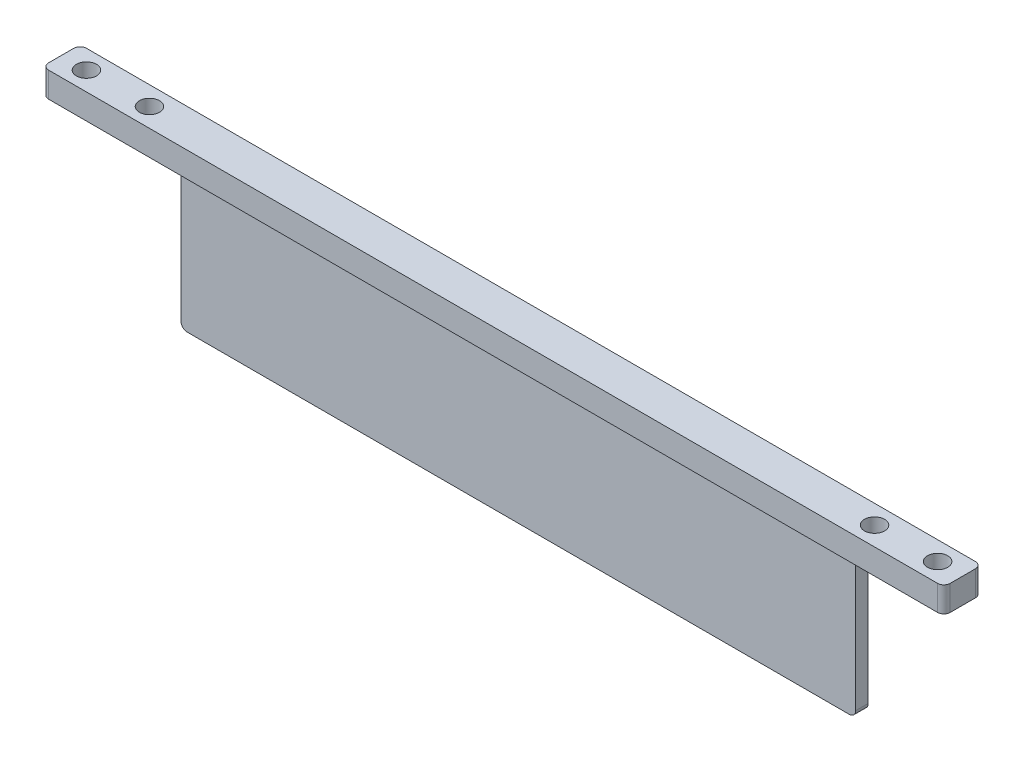
from build123d import *

# Parameters (mm, degrees)
SKETCH_1_W          = 143
SKETCH_1_H          = 6
SKETCH_1_R          = 1.6
EXTRUDE_1_DEPTH     = 4
SKETCH_2_W          = 107
SKETCH_2_H          = 2
EXTRUDE_2_DEPTH     = 40
SKETCH_3_W          = 107
SKETCH_3_H          = 15
CUT_EXTRUDE_1_DEPTH = 145.696233538
FILLET_2_R          = 1


with BuildPart() as part:
    # 草图1 → 凸台-拉伸1 (new body)
    with BuildSketch(Plane(origin=(0, 0, 0), x_dir=(1, 0, 0), z_dir=(0, 1, 0))):
        with Locations((67.5, 0)):
            Rectangle(SKETCH_1_W, SKETCH_1_H)
        with Locations(Location((0, 0, 0), (0, 0, 270))):
            Circle(SKETCH_1_R, mode=Mode.SUBTRACT)
        with Locations(Location((10, 0, 0), (0, 0, 270))):
            Circle(SKETCH_1_R, mode=Mode.SUBTRACT)
        with Locations(Location((125, 0, 0), (0, 0, 270))):
            Circle(SKETCH_1_R, mode=Mode.SUBTRACT)
        with Locations(Location((135, 0, 0), (0, 0, 270))):
            Circle(SKETCH_1_R, mode=Mode.SUBTRACT)
    extrude(amount=EXTRUDE_1_DEPTH)

    # 草图2 → 凸台-拉伸2 (add)
    with BuildSketch(Plane.XZ):
        with Locations((67.5, -2)):
            Rectangle(SKETCH_2_W, SKETCH_2_H)
    extrude(amount=EXTRUDE_2_DEPTH)

    # 草图3 → 切除-拉伸1 (cut, through all)
    with BuildSketch(Plane.XY.offset(-1)):
        with Locations((67.5, -32.5)):
            Rectangle(SKETCH_3_W, SKETCH_3_H)
    extrude(amount=-CUT_EXTRUDE_1_DEPTH, mode=Mode.SUBTRACT)

    # 圆角2
    fillet_2_edges = [part.edges().sort_by_distance(p)[0] for p in [
        (14, 0, -2),
        (121, 0, -2),
        (14, -25, -2),
        (121, -25, -2),
        (-4, 2, -3),
        (139, 2, -3),
        (139, 2, 3),
        (-4, 2, 3),
    ]]
    fillet(fillet_2_edges, radius=FILLET_2_R)


solid = part.part
